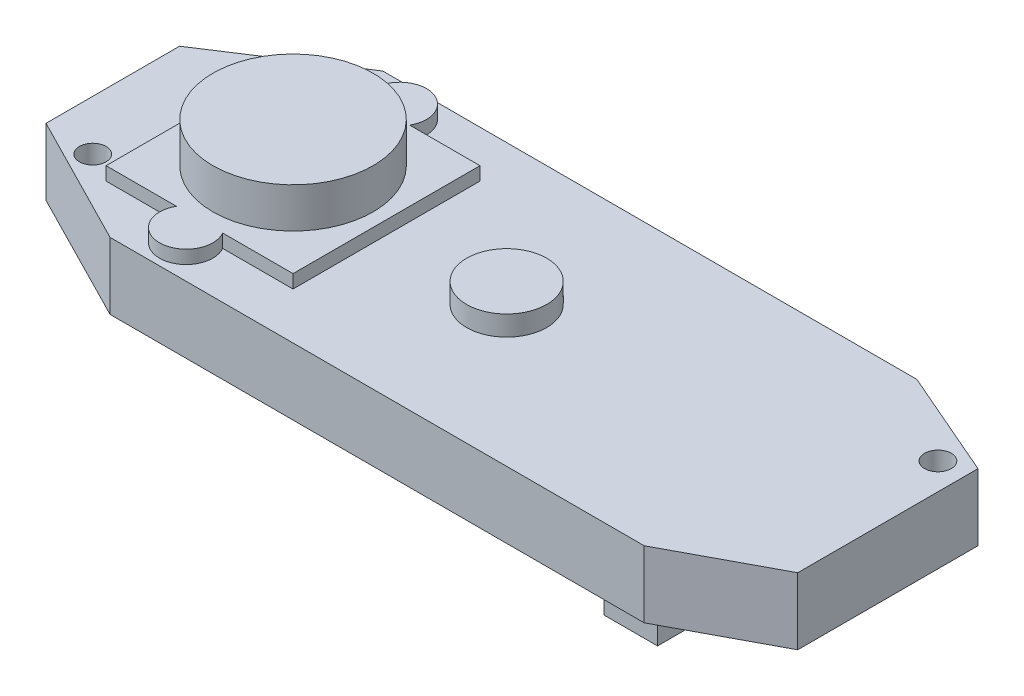
from build123d import *

# Parameters (mm, degrees)
EXTRUDE_1_DEPTH     = 5
EXTRUDE_2_DEPTH     = 1
SKETCH_3_R          = 6
EXTRUDE_3_DEPTH     = 3
SKETCH_4_R          = 3
EXTRUDE_4_DEPTH     = 1.5
SKETCH_6_W          = 4
SKETCH_6_H          = 6
EXTRUDE_5_DEPTH     = 2.5
SKETCH_7_R          = 1
CUT_EXTRUDE_1_DEPTH = 5


with BuildPart() as part:
    # Эскиз1 → Бобышка-Вытянуть1 (new body)
    with BuildSketch(Plane(origin=(0, 0, 0), x_dir=(1, 0, 0), z_dir=(0, 1, 0))):
        Polygon((-29.797958971, -5), (-29.797958971, 5), (-20.578414514, 11), (19.421585486, 11), (27.5, 7.5), (27.5, -6), (20, -10), (-20, -10), align=None)
    extrude(amount=EXTRUDE_1_DEPTH)

    # Эскиз2 → Бобышка-Вытянуть2 (add)
    with BuildSketch(Plane(origin=(0, 5, 0), x_dir=(1, 0, 0), z_dir=(0, 1, 0))):
        with BuildLine():
            Line((-23.797958971, 7.5), (-18.530009779, 7.5))
            ThreePointArc((-18.530009779, 7.5), (-16.797958971, 10.5), (-15.065908164, 7.5))
            Line((-15.065908164, 7.5), (-9.797958971, 7.5))
            Line((-9.797958971, 7.5), (-9.797958971, -6.5))
            Line((-9.797958971, -6.5), (-15.065908164, -6.5))
            ThreePointArc((-15.065908164, -6.5), (-16.797958971, -9.5), (-18.530009779, -6.5))
            Line((-18.530009779, -6.5), (-23.797958971, -6.5))
            Line((-23.797958971, -6.5), (-23.797958971, 7.5))
        make_face()
    extrude(amount=EXTRUDE_2_DEPTH)

    # Эскиз3 → Бобышка-Вытянуть3 (add)
    with BuildSketch(Plane(origin=(0, 6, 0), x_dir=(1, 0, 0), z_dir=(0, 1, 0))):
        with Locations(Location((-16.797958971, 0.5, 0), (0, 0, 270))):
            Circle(SKETCH_3_R)
    extrude(amount=EXTRUDE_3_DEPTH)

    # Эскиз4 → Бобышка-Вытянуть4 (add)
    with BuildSketch(Plane(origin=(0, 5, 0), x_dir=(1, 0, 0), z_dir=(0, 1, 0))):
        with Locations(Location((-0.797958971, 0.5, 0), (0, 0, 90))):
            Circle(SKETCH_4_R)
    extrude(amount=EXTRUDE_4_DEPTH)

    # Эскиз6 → Бобышка-Вытянуть5 (add)
    with BuildSketch(Plane.XZ):
        with Locations((17.5, 5.5)):
            Rectangle(SKETCH_6_W, SKETCH_6_H)
    extrude(amount=EXTRUDE_5_DEPTH)

    # Эскиз7 → Вырез-Вытянуть1 (cut)
    with BuildSketch(Plane(origin=(0, 5, 0), x_dir=(1, 0, 0), z_dir=(0, 1, 0))):
        with Locations(Location((-26.047958971, -5.25, 0), (0, 0, 270))):
            Circle(SKETCH_7_R)
        with Locations(Location((25.5, 6.5, 0), (0, 0, 270))):
            Circle(SKETCH_7_R)
    extrude(amount=-CUT_EXTRUDE_1_DEPTH, mode=Mode.SUBTRACT)


solid = part.part
